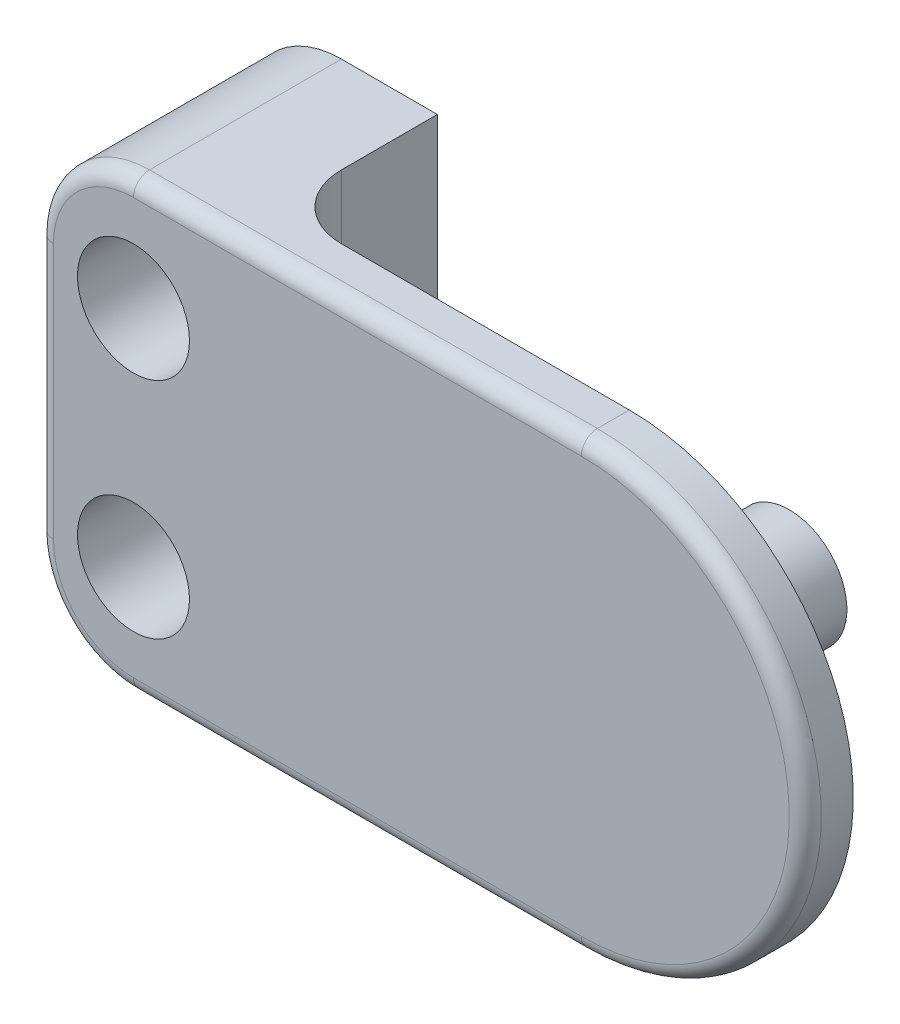
from build123d import *
from build123d.topology import SkipClean

# Parameters (mm, degrees)
SKETCH1_R           = 1.1
BOSS_EXTRUDE1_DEPTH = 1.5
SKETCH2_R           = 2.5
BOSS_EXTRUDE2_DEPTH = 1
BOSS_EXTRUDE3_DEPTH = 4
BOSS_EXTRUDE4_START = 5
SKETCH4_W           = 6
SKETCH4_H           = 14
SKETCH4_R           = 1.1
BOSS_EXTRUDE4_DEPTH = 5
FILLET4_R           = 3
FILLET1_R           = 0.5
SKETCH5_R           = 1.75
CUT_EXTRUDE1_DEPTH  = 4
FILLET3_R           = 2


with BuildPart() as part:
    # Sketch1 → Boss-Extrude1 (new body)
    with BuildSketch(Plane.XY):
        with BuildLine():
            Line((-17, 7), (0, 7))
            ThreePointArc((0, 7), (7, 0), (0, -7))
            Line((0, -7), (-17, -7))
            Line((-17, -7), (-17, 7))
        make_face()
        with Locations((-14, 3.5)):
            Circle(SKETCH1_R, mode=Mode.SUBTRACT)
        with Locations(Location((-14, -3.5, 0), (0, 0, 180))):
            Circle(SKETCH1_R, mode=Mode.SUBTRACT)
    extrude(amount=BOSS_EXTRUDE1_DEPTH)

    # Sketch2 → Boss-Extrude2 (add)
    with BuildSketch(Plane(origin=(0, 0, 0), x_dir=(-1, 0, 0), z_dir=(0, 0, -1))):
        Circle(SKETCH2_R)
    extrude(amount=BOSS_EXTRUDE2_DEPTH)

    # Sketch3 → Boss-Extrude3 (add)
    with BuildSketch(Plane(origin=(0, 0, -1), x_dir=(-1, 0, 0), z_dir=(0, 0, -1))):
        with BuildLine():
            Line((1.13862177, 1.394109201), (1.13862177, -1.394109201))
            ThreePointArc((1.13862177, -1.394109201), (-1.8, 0), (1.13862177, 1.394109201))
        make_face()
    extrude(amount=BOSS_EXTRUDE3_DEPTH)

    # Sketch4 → Boss-Extrude4 (add)
    with SkipClean():  # the faces are left unmerged after this step: merging them gives an invalid solid
        with BuildSketch(Plane(origin=(0, 0, 0), x_dir=(-1, 0, 0), z_dir=(0, 0, -1)).offset(BOSS_EXTRUDE4_START)):
            with Locations((14, 0)):
                Rectangle(SKETCH4_W, SKETCH4_H)
            with Locations((14, 3.5)):
                Circle(SKETCH4_R, mode=Mode.SUBTRACT)
            with Locations((14, -3.5)):
                Circle(SKETCH4_R, mode=Mode.SUBTRACT)
        extrude(amount=-BOSS_EXTRUDE4_DEPTH)

    # Fillet4
    fillet4_edges = [part.edges().sort_by_distance(p)[0] for p in [
        (-17, -7, -2.5),
        (-17, 7, -2.5),
    ]]
    fillet(fillet4_edges, radius=FILLET4_R)

    # Fillet1
    fillet1_edges = [part.edges().sort_by_distance(p)[0] for p in [
        (7, 0, 1.5),
        (-17, 0, 1.5),
        (-7, -7, 1.5),
        (-16.121320344, -6.121320344, 1.5),
        (-16.121320344, 6.121320344, 1.5),
        (-7, 7, 1.5),
    ]]
    fillet(fillet1_edges, radius=FILLET1_R)

    # Sketch5 → Cut-Extrude1 (cut)
    with BuildSketch(Plane.XY.offset(1.5)):
        with Locations((-14, 3.5)):
            Circle(SKETCH5_R)
        with Locations((-14, -3.5)):
            Circle(SKETCH5_R)
    extrude(amount=-CUT_EXTRUDE1_DEPTH, mode=Mode.SUBTRACT)

    # Fillet3
    fillet3_edges = [part.edges().sort_by_distance(p)[0] for p in [
        (-11, 0, 0),
    ]]
    fillet(fillet3_edges, radius=FILLET3_R)


solid = part.part
